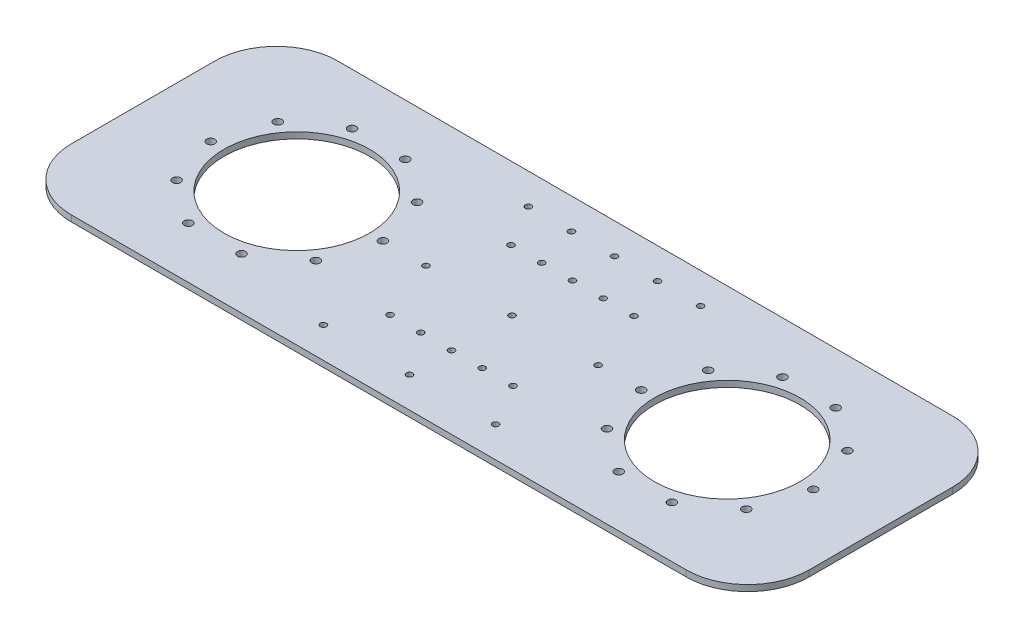
from build123d import *

# Parameters (mm, degrees)
SKETCH_1_R               = 35.5
EXTRUDE_1_DEPTH          = 3
CUT_EXTRUDE_1_REACH      = 193.4
SKETCH_3_R               = 2
PATTERN_CIRCULAR_1_COUNT = 10
MIRROR_1_COPY_1_REACH    = 193.4
MIRROR_1_COPY_1_SKETCH_R = 2
MIRROR_1_COPY_2_REACH    = 193.4
MIRROR_1_COPY_2_SKETCH_R = 2
MIRROR_1_COPY_3_REACH    = 193.4
MIRROR_1_COPY_3_SKETCH_R = 2
MIRROR_1_COPY_4_REACH    = 193.4
MIRROR_1_COPY_4_SKETCH_R = 2
MIRROR_1_COPY_5_REACH    = 193.4
MIRROR_1_COPY_5_SKETCH_R = 2
MIRROR_1_COPY_6_REACH    = 193.4
MIRROR_1_COPY_6_SKETCH_R = 2
MIRROR_1_COPY_7_REACH    = 193.4
MIRROR_1_COPY_7_SKETCH_R = 2
MIRROR_1_COPY_8_REACH    = 193.4
MIRROR_1_COPY_8_SKETCH_R = 2
MIRROR_1_COPY_9_REACH    = 193.4
MIRROR_1_COPY_9_SKETCH_R = 2
CUT_EXTRUDE_2_REACH      = 193.4
SKETCH_4_R               = 1.5
PATTERN_LINEAR_1_COUNT   = 5
PATTERN_LINEAR_1_PITCH   = 21
CUT_EXTRUDE_3_REACH      = 193.4
SKETCH_6_R               = 1.5
PATTERN_LINEAR_3_COUNT   = 5
PATTERN_LINEAR_3_PITCH   = 15
MIRROR_2_COPY_1_REACH    = 193.4
MIRROR_2_COPY_1_SKETCH_R = 1.5
MIRROR_2_COPY_2_REACH    = 193.4
MIRROR_2_COPY_2_SKETCH_R = 1.5
MIRROR_2_COPY_3_REACH    = 193.4
MIRROR_2_COPY_3_SKETCH_R = 1.5
MIRROR_2_COPY_4_REACH    = 193.4
MIRROR_2_COPY_4_SKETCH_R = 1.5
CUT_EXTRUDE_4_REACH      = 193.4
SKETCH_7_R               = 1.5
PATTERN_LINEAR_4_COUNT   = 2
PATTERN_LINEAR_4_PITCH   = 50


with BuildPart() as part:
    # 草圖1 → 填料-伸長1 (new body)
    with BuildSketch(Plane(origin=(0, 0, 0), x_dir=(1, 0, 0), z_dir=(0, 1, 0))):
        with BuildLine():
            Line((-150, 65), (150, 65))
            ThreePointArc((150, 65), (171.213203436, 56.213203436), (180, 35))
            Line((180, 35), (180, -35))
            ThreePointArc((180, -35), (171.213203436, -56.213203436), (150, -65))
            Line((150, -65), (-150, -65))
            ThreePointArc((-150, -65), (-171.213203436, -56.213203436), (-180, -35))
            Line((-180, -35), (-180, 35))
            ThreePointArc((-180, 35), (-171.213203436, 56.213203436), (-150, 65))
        make_face()
        with Locations(Location((105, 0, 0), (0, 0, 270))):
            Circle(SKETCH_1_R, mode=Mode.SUBTRACT)
        with Locations(Location((-105, 0, 0), (0, 0, 270))):
            Circle(SKETCH_1_R, mode=Mode.SUBTRACT)
    extrude(amount=EXTRUDE_1_DEPTH)

    # 草圖3 → 除料-伸長1 (cut, up to next)
    with BuildSketch(Plane(origin=(0, 3, 0), x_dir=(1, 0, 0), z_dir=(0, 1, 0)), mode=Mode.PRIVATE) as cut_extrude_1_sk1:
        with Locations(Location((-63, 0, 0), (0, 0, 270))):
            Circle(SKETCH_3_R)
    cut_extrude_1_tool1 = extrude(cut_extrude_1_sk1.sketch, amount=-CUT_EXTRUDE_1_REACH, mode=Mode.PRIVATE) & part.part
    cut_extrude_1 = cut_extrude_1_tool1.solids().sort_by_distance((-63, 3, 0))[0]
    add(cut_extrude_1, mode=Mode.SUBTRACT)

    # 環狀複製排列1: 除料-伸長1 ×10 about axis
    pattern_circular_1_axis = Axis((-105, 0, 0), (0, 1, 0))
    for i in range(1, PATTERN_CIRCULAR_1_COUNT):
        add(cut_extrude_1.rotate(pattern_circular_1_axis, i * 360 / PATTERN_CIRCULAR_1_COUNT), mode=Mode.SUBTRACT)

    # 鏡射1: 除料-伸長1 across plane
    add(cut_extrude_1.mirror(Plane(origin=(0, 0, 0), x_dir=(0, 0, 1), z_dir=(1, 0, 0))), mode=Mode.SUBTRACT)

    # 鏡射1 copy 1 sketch → 鏡射1 copy 1 (cut, up to next)
    with BuildSketch(Plane(origin=(20.053215591, 3, -61.717451491), x_dir=(-0.8090169943749475, 0, -0.5877852522924731), z_dir=(0, 1, 0)), mode=Mode.PRIVATE) as mirror_1_copy_1_sk1:
        with Locations((-63, 0)):
            Circle(MIRROR_1_COPY_1_SKETCH_R)
    mirror_1_copy_1_tool1 = extrude(mirror_1_copy_1_sk1.sketch, amount=-MIRROR_1_COPY_1_REACH, mode=Mode.PRIVATE) & part.part
    add(mirror_1_copy_1_tool1.solids().sort_by_distance((71.021286236, 3, -24.686980596))[0], mode=Mode.SUBTRACT)

    # 鏡射1 copy 2 sketch → 鏡射1 copy 2 (cut, up to next)
    with BuildSketch(Plane(origin=(72.553215591, 3, -99.860934211), x_dir=(-0.30901699437494745, 0, -0.9510565162951535), z_dir=(0, 1, 0)), mode=Mode.PRIVATE) as mirror_1_copy_2_sk1:
        with Locations((-63, 0)):
            Circle(MIRROR_1_COPY_2_SKETCH_R)
    mirror_1_copy_2_tool1 = extrude(mirror_1_copy_2_sk1.sketch, amount=-MIRROR_1_COPY_2_REACH, mode=Mode.PRIVATE) & part.part
    add(mirror_1_copy_2_tool1.solids().sort_by_distance((92.021286236, 3, -39.944373684))[0], mode=Mode.SUBTRACT)

    # 鏡射1 copy 3 sketch → 鏡射1 copy 3 (cut, up to next)
    with BuildSketch(Plane(origin=(137.446784409, 3, -99.860934211), x_dir=(0.30901699437494734, 0, -0.9510565162951536), z_dir=(0, 1, 0)), mode=Mode.PRIVATE) as mirror_1_copy_3_sk1:
        with Locations((-63, 0)):
            Circle(MIRROR_1_COPY_3_SKETCH_R)
    mirror_1_copy_3_tool1 = extrude(mirror_1_copy_3_sk1.sketch, amount=-MIRROR_1_COPY_3_REACH, mode=Mode.PRIVATE) & part.part
    add(mirror_1_copy_3_tool1.solids().sort_by_distance((117.978713764, 3, -39.944373684))[0], mode=Mode.SUBTRACT)

    # 鏡射1 copy 4 sketch → 鏡射1 copy 4 (cut, up to next)
    with BuildSketch(Plane(origin=(189.946784409, 3, -61.717451491), x_dir=(0.8090169943749473, 0, -0.5877852522924732), z_dir=(0, 1, 0)), mode=Mode.PRIVATE) as mirror_1_copy_4_sk1:
        with Locations((-63, 0)):
            Circle(MIRROR_1_COPY_4_SKETCH_R)
    mirror_1_copy_4_tool1 = extrude(mirror_1_copy_4_sk1.sketch, amount=-MIRROR_1_COPY_4_REACH, mode=Mode.PRIVATE) & part.part
    add(mirror_1_copy_4_tool1.solids().sort_by_distance((138.978713764, 3, -24.686980596))[0], mode=Mode.SUBTRACT)

    # 鏡射1 copy 5 sketch → 鏡射1 copy 5 (cut, up to next)
    with BuildSketch(Plane(origin=(210, 3, 0), x_dir=(1, 0, 0), z_dir=(0, 1, 0)), mode=Mode.PRIVATE) as mirror_1_copy_5_sk1:
        with Locations((-63, 0)):
            Circle(MIRROR_1_COPY_5_SKETCH_R)
    mirror_1_copy_5_tool1 = extrude(mirror_1_copy_5_sk1.sketch, amount=-MIRROR_1_COPY_5_REACH, mode=Mode.PRIVATE) & part.part
    add(mirror_1_copy_5_tool1.solids().sort_by_distance((147, 3, 0))[0], mode=Mode.SUBTRACT)

    # 鏡射1 copy 6 sketch → 鏡射1 copy 6 (cut, up to next)
    with BuildSketch(Plane(origin=(189.946784409, 3, 61.717451491), x_dir=(0.8090169943749476, 0, 0.587785252292473), z_dir=(0, 1, 0)), mode=Mode.PRIVATE) as mirror_1_copy_6_sk1:
        with Locations((-63, 0)):
            Circle(MIRROR_1_COPY_6_SKETCH_R)
    mirror_1_copy_6_tool1 = extrude(mirror_1_copy_6_sk1.sketch, amount=-MIRROR_1_COPY_6_REACH, mode=Mode.PRIVATE) & part.part
    add(mirror_1_copy_6_tool1.solids().sort_by_distance((138.978713764, 3, 24.686980596))[0], mode=Mode.SUBTRACT)

    # 鏡射1 copy 7 sketch → 鏡射1 copy 7 (cut, up to next)
    with BuildSketch(Plane(origin=(137.446784409, 3, 99.860934211), x_dir=(0.30901699437494756, 0, 0.9510565162951535), z_dir=(0, 1, 0)), mode=Mode.PRIVATE) as mirror_1_copy_7_sk1:
        with Locations((-63, 0)):
            Circle(MIRROR_1_COPY_7_SKETCH_R)
    mirror_1_copy_7_tool1 = extrude(mirror_1_copy_7_sk1.sketch, amount=-MIRROR_1_COPY_7_REACH, mode=Mode.PRIVATE) & part.part
    add(mirror_1_copy_7_tool1.solids().sort_by_distance((117.978713764, 3, 39.944373684))[0], mode=Mode.SUBTRACT)

    # 鏡射1 copy 8 sketch → 鏡射1 copy 8 (cut, up to next)
    with BuildSketch(Plane(origin=(72.553215591, 3, 99.860934211), x_dir=(-0.30901699437494723, 0, 0.9510565162951536), z_dir=(0, 1, 0)), mode=Mode.PRIVATE) as mirror_1_copy_8_sk1:
        with Locations((-63, 0)):
            Circle(MIRROR_1_COPY_8_SKETCH_R)
    mirror_1_copy_8_tool1 = extrude(mirror_1_copy_8_sk1.sketch, amount=-MIRROR_1_COPY_8_REACH, mode=Mode.PRIVATE) & part.part
    add(mirror_1_copy_8_tool1.solids().sort_by_distance((92.021286236, 3, 39.944373684))[0], mode=Mode.SUBTRACT)

    # 鏡射1 copy 9 sketch → 鏡射1 copy 9 (cut, up to next)
    with BuildSketch(Plane(origin=(20.053215591, 3, 61.717451491), x_dir=(-0.8090169943749473, 0, 0.5877852522924734), z_dir=(0, 1, 0)), mode=Mode.PRIVATE) as mirror_1_copy_9_sk1:
        with Locations((-63, 0)):
            Circle(MIRROR_1_COPY_9_SKETCH_R)
    mirror_1_copy_9_tool1 = extrude(mirror_1_copy_9_sk1.sketch, amount=-MIRROR_1_COPY_9_REACH, mode=Mode.PRIVATE) & part.part
    add(mirror_1_copy_9_tool1.solids().sort_by_distance((71.021286236, 3, 24.686980596))[0], mode=Mode.SUBTRACT)

    # 草圖4 → 除料-伸長2 (cut, up to next)
    with BuildSketch(Plane(origin=(0, 3, 0), x_dir=(1, 0, 0), z_dir=(0, 1, 0)), mode=Mode.PRIVATE) as cut_extrude_2_sk1:
        with Locations(Location((42, 50, 0), (0, 0, 270))):
            Circle(SKETCH_4_R)
    cut_extrude_2_tool1 = extrude(cut_extrude_2_sk1.sketch, amount=-CUT_EXTRUDE_2_REACH, mode=Mode.PRIVATE) & part.part
    cut_extrude_2 = cut_extrude_2_tool1.solids().sort_by_distance((42, 3, -50))[0]
    add(cut_extrude_2, mode=Mode.SUBTRACT)

    # 直線複製排列1: 除料-伸長2 ×5
    with Locations(*[(-i * PATTERN_LINEAR_1_PITCH, 0, 0) for i in range(1, PATTERN_LINEAR_1_COUNT)]):
        add(cut_extrude_2, mode=Mode.SUBTRACT)

    # 草圖6 → 除料-伸長3 (cut, up to next)
    with BuildSketch(Plane(origin=(0, 3, 0), x_dir=(1, 0, 0), z_dir=(0, 1, 0)), mode=Mode.PRIVATE) as cut_extrude_3_sk1:
        with Locations(Location((30, 29.5, 0), (0, 0, 270))):
            Circle(SKETCH_6_R)
    cut_extrude_3_tool1 = extrude(cut_extrude_3_sk1.sketch, amount=-CUT_EXTRUDE_3_REACH, mode=Mode.PRIVATE) & part.part
    cut_extrude_3 = cut_extrude_3_tool1.solids().sort_by_distance((30, 3, -29.5))[0]
    add(cut_extrude_3, mode=Mode.SUBTRACT)

    # 直線複製排列3: 除料-伸長3 ×5
    with Locations(*[(-i * PATTERN_LINEAR_3_PITCH, 0, 0) for i in range(1, PATTERN_LINEAR_3_COUNT)]):
        add(cut_extrude_3, mode=Mode.SUBTRACT)

    # 鏡射2: 除料-伸長3 across plane
    add(cut_extrude_3.mirror(Plane.XY), mode=Mode.SUBTRACT)

    # 鏡射2 copy 1 sketch → 鏡射2 copy 1 (cut, up to next)
    with BuildSketch(Plane(origin=(-15, 3, 0), x_dir=(1, 0, 0), z_dir=(0, 1, 0)), mode=Mode.PRIVATE) as mirror_2_copy_1_sk1:
        with Locations((30, -29.5)):
            Circle(MIRROR_2_COPY_1_SKETCH_R)
    mirror_2_copy_1_tool1 = extrude(mirror_2_copy_1_sk1.sketch, amount=-MIRROR_2_COPY_1_REACH, mode=Mode.PRIVATE) & part.part
    add(mirror_2_copy_1_tool1.solids().sort_by_distance((15, 3, 29.5))[0], mode=Mode.SUBTRACT)

    # 鏡射2 copy 2 sketch → 鏡射2 copy 2 (cut, up to next)
    with BuildSketch(Plane(origin=(-30, 3, 0), x_dir=(1, 0, 0), z_dir=(0, 1, 0)), mode=Mode.PRIVATE) as mirror_2_copy_2_sk1:
        with Locations((30, -29.5)):
            Circle(MIRROR_2_COPY_2_SKETCH_R)
    mirror_2_copy_2_tool1 = extrude(mirror_2_copy_2_sk1.sketch, amount=-MIRROR_2_COPY_2_REACH, mode=Mode.PRIVATE) & part.part
    add(mirror_2_copy_2_tool1.solids().sort_by_distance((0, 3, 29.5))[0], mode=Mode.SUBTRACT)

    # 鏡射2 copy 3 sketch → 鏡射2 copy 3 (cut, up to next)
    with BuildSketch(Plane(origin=(-45, 3, 0), x_dir=(1, 0, 0), z_dir=(0, 1, 0)), mode=Mode.PRIVATE) as mirror_2_copy_3_sk1:
        with Locations((30, -29.5)):
            Circle(MIRROR_2_COPY_3_SKETCH_R)
    mirror_2_copy_3_tool1 = extrude(mirror_2_copy_3_sk1.sketch, amount=-MIRROR_2_COPY_3_REACH, mode=Mode.PRIVATE) & part.part
    add(mirror_2_copy_3_tool1.solids().sort_by_distance((-15, 3, 29.5))[0], mode=Mode.SUBTRACT)

    # 鏡射2 copy 4 sketch → 鏡射2 copy 4 (cut, up to next)
    with BuildSketch(Plane(origin=(-60, 3, 0), x_dir=(1, 0, 0), z_dir=(0, 1, 0)), mode=Mode.PRIVATE) as mirror_2_copy_4_sk1:
        with Locations((30, -29.5)):
            Circle(MIRROR_2_COPY_4_SKETCH_R)
    mirror_2_copy_4_tool1 = extrude(mirror_2_copy_4_sk1.sketch, amount=-MIRROR_2_COPY_4_REACH, mode=Mode.PRIVATE) & part.part
    add(mirror_2_copy_4_tool1.solids().sort_by_distance((-30, 3, 29.5))[0], mode=Mode.SUBTRACT)

    # 草圖7 → 除料-伸長4 (cut, up to next)
    with BuildSketch(Plane(origin=(0, 3, 0), x_dir=(1, 0, 0), z_dir=(0, 1, 0)), mode=Mode.PRIVATE) as cut_extrude_4_sk1:
        with Locations(Location((42, 0, 0), (0, 0, 270))):
            Circle(SKETCH_7_R)
    cut_extrude_4_tool1 = extrude(cut_extrude_4_sk1.sketch, amount=-CUT_EXTRUDE_4_REACH, mode=Mode.PRIVATE) & part.part
    # 草圖7 → 除料-伸長4 (cut, up to next)
    with BuildSketch(Plane(origin=(0, 3, 0), x_dir=(1, 0, 0), z_dir=(0, 1, 0)), mode=Mode.PRIVATE) as cut_extrude_4_sk2:
        with Locations(Location((0, 0, 0), (0, 0, 270))):
            Circle(SKETCH_7_R)
    cut_extrude_4_tool2 = extrude(cut_extrude_4_sk2.sketch, amount=-CUT_EXTRUDE_4_REACH, mode=Mode.PRIVATE) & part.part
    # 草圖7 → 除料-伸長4 (cut, up to next)
    with BuildSketch(Plane(origin=(0, 3, 0), x_dir=(1, 0, 0), z_dir=(0, 1, 0)), mode=Mode.PRIVATE) as cut_extrude_4_sk3:
        with Locations(Location((-42, 0, 0), (0, 0, 270))):
            Circle(SKETCH_7_R)
    cut_extrude_4_tool3 = extrude(cut_extrude_4_sk3.sketch, amount=-CUT_EXTRUDE_4_REACH, mode=Mode.PRIVATE) & part.part
    cut_extrude_4_1 = cut_extrude_4_tool1.solids().sort_by_distance((42, 3, 0))[0]
    add(cut_extrude_4_1, mode=Mode.SUBTRACT)
    cut_extrude_4_2 = cut_extrude_4_tool2.solids().sort_by_distance((0, 3, 0))[0]
    add(cut_extrude_4_2, mode=Mode.SUBTRACT)
    cut_extrude_4_3 = cut_extrude_4_tool3.solids().sort_by_distance((-42, 3, 0))[0]
    add(cut_extrude_4_3, mode=Mode.SUBTRACT)
    cut_extrude_4 = cut_extrude_4_1 + cut_extrude_4_2 + cut_extrude_4_3  # 除料-伸長4 as one shape, for the pattern or mirror that repeats it

    # 直線複製排列4: 除料-伸長4 ×2
    with Locations(*[(0, 0, i * PATTERN_LINEAR_4_PITCH) for i in range(1, PATTERN_LINEAR_4_COUNT)]):
        add(cut_extrude_4, mode=Mode.SUBTRACT)


solid = part.part
